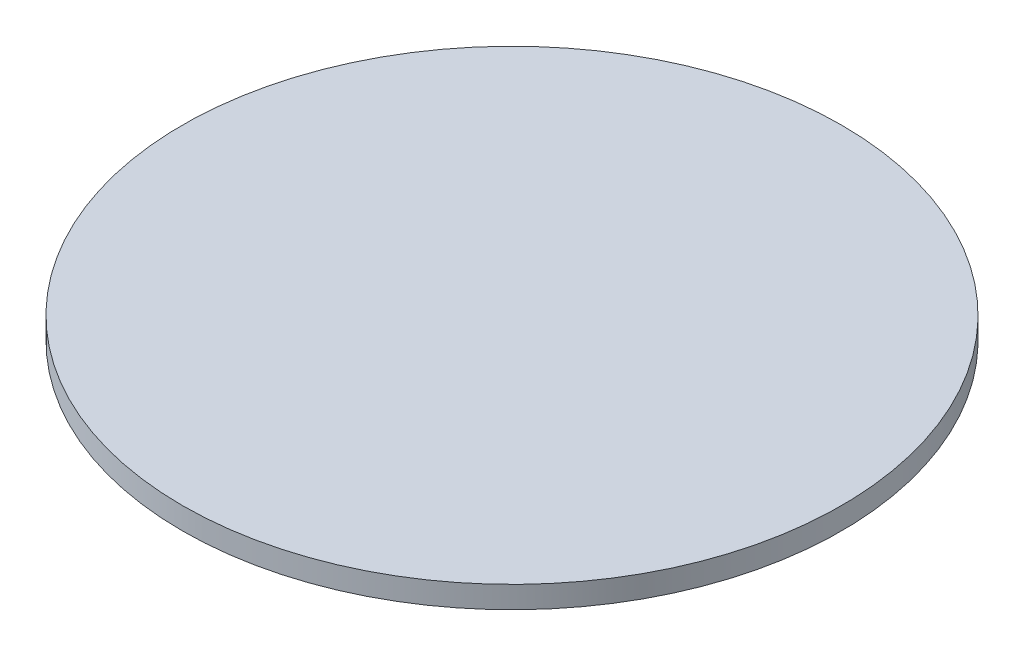
from build123d import *

# Parameters (mm, degrees)
SKETCH1_R           = 150
BOSS_EXTRUDE1_DEPTH = 10


with BuildPart() as part:
    # Sketch1 → Boss-Extrude1 (new body)
    with BuildSketch(Plane(origin=(0, 0, 0), x_dir=(1, 0, 0), z_dir=(0, 1, 0))):
        with Locations(Location((0, 0, 0), (0, 0, 270))):
            Circle(SKETCH1_R)
    extrude(amount=BOSS_EXTRUDE1_DEPTH)


solid = part.part
